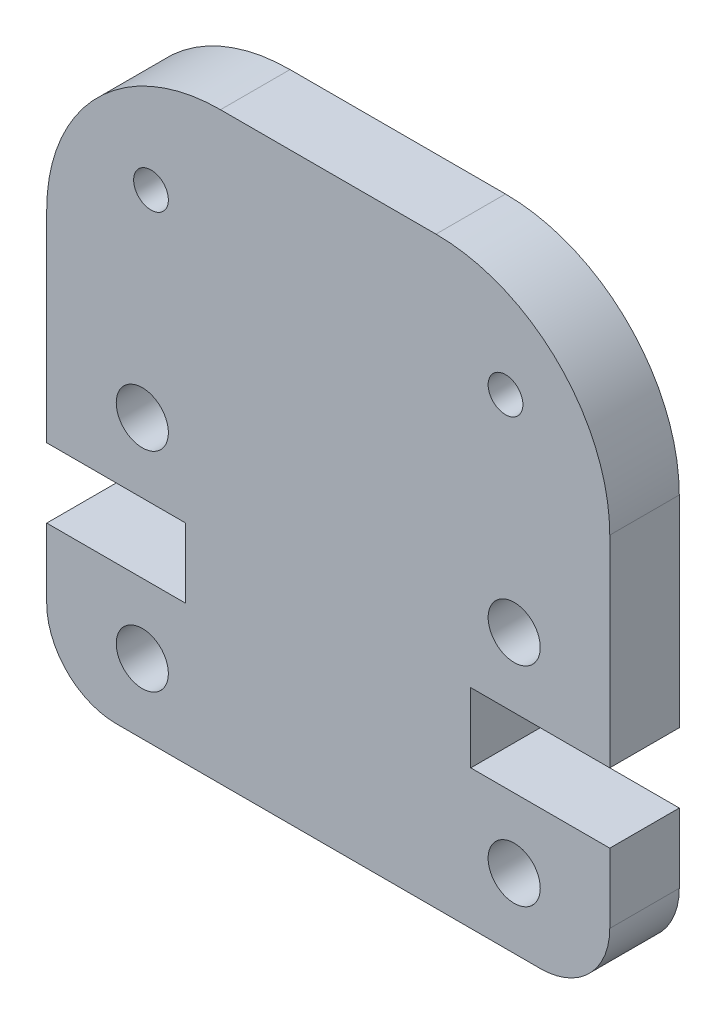
from build123d import *

# Parameters (mm, degrees)
SKETCH1_R           = 0.5
SKETCH1_R_2         = 0.75
BOSS_EXTRUDE1_DEPTH = 2


with BuildPart() as part:
    # Sketch1 → Boss-Extrude1 (new body)
    with BuildSketch(Plane.XY):
        with BuildLine():
            Line((0, 6), (0, 11.8))
            ThreePointArc((0, 11.8), (1.464466094, 15.335533906), (5, 16.8))
            Line((5, 16.8), (11.2, 16.8))
            ThreePointArc((11.2, 16.8), (14.735533906, 15.335533906), (16.2, 11.8))
            Line((16.2, 11.8), (16.2, 6))
            Line((16.2, 6), (12.2, 6))
            Line((12.2, 6), (12.2, 4))
            Line((12.2, 4), (16.2, 4))
            Line((16.2, 4), (16.2, 2))
            ThreePointArc((16.2, 2), (15.614213562, 0.585786438), (14.2, 0))
            Line((14.2, 0), (2, 0))
            ThreePointArc((2, 0), (0.585786438, 0.585786438), (0, 2))
            Line((0, 2), (0, 4))
            Line((0, 4), (4, 4))
            Line((4, 4), (4, 6))
            Line((4, 6), (0, 6))
        make_face()
        with Locations((3, 13.8)):
            Circle(SKETCH1_R, mode=Mode.SUBTRACT)
        with Locations((13.2, 13.8)):
            Circle(SKETCH1_R, mode=Mode.SUBTRACT)
        with Locations(Location((13.45, 8, 0), (0, 0, 180))):
            Circle(SKETCH1_R_2, mode=Mode.SUBTRACT)
        with Locations(Location((2.75, 8, 0), (0, 0, 180))):
            Circle(SKETCH1_R_2, mode=Mode.SUBTRACT)
        with Locations((13.45, 2)):
            Circle(SKETCH1_R_2, mode=Mode.SUBTRACT)
        with Locations((2.75, 2)):
            Circle(SKETCH1_R_2, mode=Mode.SUBTRACT)
    extrude(amount=BOSS_EXTRUDE1_DEPTH)


solid = part.part
